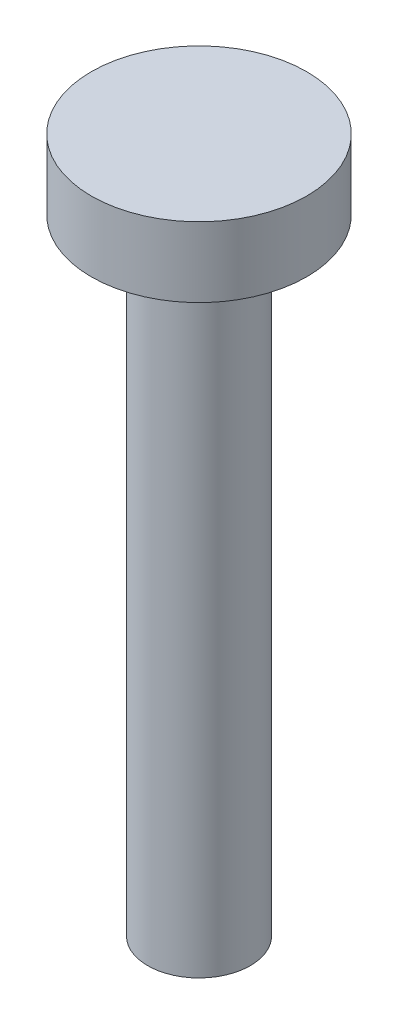
from build123d import *


with BuildPart() as part:
    # Sketch1 → Revolve1 (revolve)
    with BuildSketch(Plane.XY, mode=Mode.PRIVATE) as revolve1_sk:
        Polygon((0, 0), (4.7625, 0), (4.7625, 58), (10, 58), (10, 64.5), (0, 64.5), align=None)
    revolve(revolve1_sk.sketch.rotate(Axis((0, 0, 0), (0, 1, 0)), 90), axis=Axis((0, 0, 0), (0, 1, 0)))


solid = part.part
